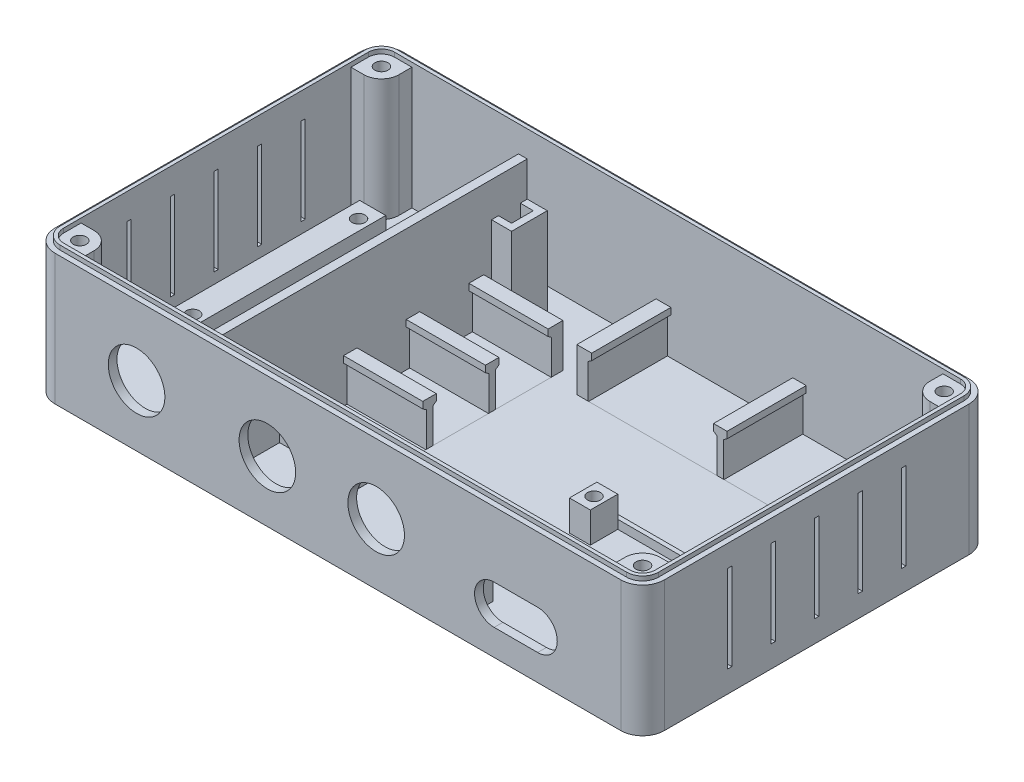
from build123d import *

# Parameters (mm, degrees)
SKETCH1_W                                  = 140
SKETCH1_H                                  = 80
BOSS_EXTRUDE1_DEPTH                        = 30
FILLET1_R                                  = 5
SHELL1_T                                   = -2
SKETCH2_W                                  = 6
SKETCH2_H                                  = 45.65
BOSS_EXTRUDE2_DEPTH                        = 4.5
SKETCH3_W                                  = 0.5
SKETCH3_H                                  = 5
CUT_EXTRUDE1_DEPTH                         = 1.5
SKETCH4_R                                  = 1.5
CUT_EXTRUDE2_DEPTH                         = 4.5
SKETCH5_W                                  = 2
SKETCH5_H                                  = 71
BOSS_EXTRUDE3_DEPTH                        = 28
BOSS_EXTRUDE4_START                        = 28
BOSS_EXTRUDE4_DEPTH                        = 28
MIRROR2_START                              = 28
MIRROR2_AT_THE_SECOND_PLANE_COPY_1_DEPTH   = 28
BOSS_EXTRUDE5_DEPTH                        = 18.2
SKETCH8_W                                  = 29.6
SKETCH8_H                                  = 18.2
CUT_EXTRUDE3_DEPTH                         = 0.1
BOSS_EXTRUDE6_DEPTH                        = 18.2
SKETCH10_W                                 = 18.2
SKETCH10_H                                 = 12.9
CUT_EXTRUDE4_DEPTH                         = 0.1
SKETCH11_R                                 = 6.5
CUT_EXTRUDE5_DEPTH                         = 110.013760599
SKETCH13_W                                 = 4.8
SKETCH13_H                                 = 6.3
SKETCH13_H_2                               = 7
BOSS_EXTRUDE7_DEPTH                        = 7
SKETCH14_W                                 = 38.2
SKETCH14_H                                 = 1
BOSS_EXTRUDE8_DEPTH                        = 2
SKETCH15_R                                 = 1.5
CUT_EXTRUDE6_DEPTH                         = 7
CUT_EXTRUDE7_DEPTH                         = 110.013760599
SKETCH19_R                                 = 1.5
CUT_EXTRUDE8_DEPTH                         = 20
MIRROR3_AT_THE_SECOND_PLANE_COPY_1_SKETC_R = 1.5
MIRROR3_AT_THE_SECOND_PLANE_COPY_1_DEPTH   = 20
BOSS_EXTRUDE9_DEPTH                        = 1
CUT_EXTRUDE9_REACH                         = 150.866
SKETCH21_W                                 = 1
SKETCH21_H                                 = 20
CUT_EXTRUDE10_REACH                        = 92
BOSS_EXTRUDE10_DEPTH                       = 20


with BuildPart() as part:
    # Sketch1 → Boss-Extrude1 (new body)
    with BuildSketch(Plane(origin=(0, 0, 0), x_dir=(1, 0, 0), z_dir=(0, 1, 0))):
        Rectangle(SKETCH1_W, SKETCH1_H)
    extrude(amount=BOSS_EXTRUDE1_DEPTH)

    # Fillet1
    fillet1_edges = [part.edges().sort_by_distance(p)[0] for p in [
        (70, 15, 40),
        (-70, 15, 40),
        (-70, 15, -40),
        (70, 15, -40),
    ]]
    fillet(fillet1_edges, radius=FILLET1_R)

    # Shell1
    shell1_openings = [part.faces().sort_by_distance(p)[0] for p in [
        (0, 30, 0),
    ]]
    offset(amount=SHELL1_T, openings=shell1_openings, kind=Kind.INTERSECTION)

    # Sketch2 → Boss-Extrude2 (add)
    with BuildSketch(Plane(origin=(0, 2, 0), x_dir=(1, 0, 0), z_dir=(0, 1, 0))):
        with Locations((-38.5, 6.175)):
            Rectangle(SKETCH2_W, SKETCH2_H)
    boss_extrude2 = extrude(amount=BOSS_EXTRUDE2_DEPTH)

    # Sketch3 → Cut-Extrude1 (cut)
    with BuildSketch(Plane(origin=(0, 6.5, 0), x_dir=(1, 0, 0), z_dir=(0, 1, 0))):
        with Locations((-41.25, 25.5)):
            Rectangle(SKETCH3_W, SKETCH3_H)
    extrude(amount=-CUT_EXTRUDE1_DEPTH, mode=Mode.SUBTRACT)

    # Mirror1: Boss-Extrude2 across plane
    add(boss_extrude2.mirror(Plane(origin=(-49.75, 0, 0), x_dir=(0, 0, 1), z_dir=(1, 0, 0))))

    # Sketch4 → Cut-Extrude2 (cut)
    with BuildSketch(Plane(origin=(0, 6.5, 0), x_dir=(1, 0, 0), z_dir=(0, 1, 0))):
        with Locations(Location((-60.475, 25.225, 0), (0, 0, 270))):
            Circle(SKETCH4_R)
        with Locations(Location((-39.025, 25.225, 0), (0, 0, 270))):
            Circle(SKETCH4_R)
        with Locations(Location((-39.025, -12.875, 0), (0, 0, 270))):
            Circle(SKETCH4_R)
        with Locations(Location((-60.475, -12.875, 0), (0, 0, 270))):
            Circle(SKETCH4_R)
    extrude(amount=-CUT_EXTRUDE2_DEPTH, mode=Mode.SUBTRACT)

    # Sketch5 → Boss-Extrude3 (add)
    with BuildSketch(Plane(origin=(0, 2, 0), x_dir=(1, 0, 0), z_dir=(0, 1, 0))):
        with Locations((-30.5, -2.5)):
            Rectangle(SKETCH5_W, SKETCH5_H)
    extrude(amount=BOSS_EXTRUDE3_DEPTH)

    # Sketch6 → Boss-Extrude4 (add)
    with BuildSketch(Plane(origin=(0, 2, 0), x_dir=(1, 0, 0), z_dir=(0, 1, 0)).offset(BOSS_EXTRUDE4_START)):
        with BuildLine():
            Line((61, 35), (61, 38))
            Line((61, 38), (65, 38))
            ThreePointArc((65, 38), (67.121320344, 37.121320344), (68, 35))
            Line((68, 35), (68, 31))
            Line((68, 31), (65, 31))
            ThreePointArc((65, 31), (62.171572875, 32.171572875), (61, 35))
        make_face()
    boss_extrude4 = extrude(amount=-BOSS_EXTRUDE4_DEPTH)

    # Mirror2: Boss-Extrude4 across plane
    add(boss_extrude4.mirror(Plane.XY))

    # Mirror2 at the second plane: Boss-Extrude4 across plane
    add(boss_extrude4.mirror(Plane(origin=(0, 0, 0), x_dir=(0, 0, 1), z_dir=(1, 0, 0))))

    # Mirror2 at the second plane copy 1 sketc → Mirror2 at the second plane copy 1 (add)
    with BuildSketch(Plane(origin=(0, 2, 0), x_dir=(-1, 0, 0), z_dir=(0, 1, 0)).offset(MIRROR2_START)):
        with BuildLine():
            Line((61, 35), (61, 38))
            Line((61, 38), (65, 38))
            ThreePointArc((65, 38), (67.121320344, 37.121320344), (68, 35))
            Line((68, 35), (68, 31))
            Line((68, 31), (65, 31))
            ThreePointArc((65, 31), (62.171572875, 32.171572875), (61, 35))
        make_face()
    extrude(amount=-MIRROR2_AT_THE_SECOND_PLANE_COPY_1_DEPTH)

    # Sketch7 → Boss-Extrude5 (add)
    with BuildSketch(Plane.XY.offset(-38)):
        Polygon((61, 2), (61, 11.960166031), (57.6, 11.960166031), (57.6, 10.460166031), (58.4, 9.9), (58.4, 2), align=None)
        Polygon((28.8, 2), (28.8, 9.9), (29.6, 10.460166031), (29.6, 11.960166031), (26.5, 11.960166031), (26.5, 10.460166031), (27.3, 9.9), (27.3, 2), align=None)
        Polygon((-2.3, 2), (-4.9, 2), (-4.9, 11.960166031), (-1.5, 11.960166031), (-1.5, 10.460166031), (-2.3, 9.9), align=None)
    extrude(amount=BOSS_EXTRUDE5_DEPTH)

    # Sketch8 → Cut-Extrude3 (cut)
    with BuildSketch(Plane(origin=(0, 2, 0), x_dir=(1, 0, 0), z_dir=(0, 1, 0))):
        with Locations((12.5, 28.9)):
            Rectangle(SKETCH8_W, SKETCH8_H)
        with Locations((43.6, 28.9)):
            Rectangle(SKETCH8_W, SKETCH8_H)
    extrude(amount=-CUT_EXTRUDE3_DEPTH, mode=Mode.SUBTRACT)

    # Sketch9 → Boss-Extrude6 (add)
    with BuildSketch(Plane(origin=(-29.5, 0, 0), x_dir=(0, 0, -1), z_dir=(1, 0, 0))):
        Polygon((23, 2), (23, 11.960166031), (19.6, 11.960166031), (19.6, 10.460166031), (20.4, 9.9), (20.4, 2), align=None)
        Polygon((7.5, 2), (7.5, 9.9), (8.3, 10.460166031), (8.3, 11.960166031), (5.2, 11.960166031), (5.2, 10.460166031), (6, 9.9), (6, 2), align=None)
        Polygon((-6.9, 2), (-6.9, 9.9), (-6.1, 10.460166031), (-6.1, 11.960166031), (-9.2, 11.960166031), (-9.2, 10.460166031), (-8.4, 9.9), (-8.4, 2), align=None)
        Polygon((-21.3, 2), (-23.9, 2), (-23.9, 11.960166031), (-20.5, 11.960166031), (-20.5, 10.460166031), (-21.3, 9.9), align=None)
    extrude(amount=BOSS_EXTRUDE6_DEPTH)

    # Sketch10 → Cut-Extrude4 (cut)
    with BuildSketch(Plane(origin=(0, 2, 0), x_dir=(1, 0, 0), z_dir=(0, 1, 0))):
        with Locations((-20.4, -14.85)):
            Rectangle(SKETCH10_W, SKETCH10_H)
        with Locations((-20.4, -0.45)):
            Rectangle(SKETCH10_W, SKETCH10_H)
        with Locations((-20.4, 13.95)):
            Rectangle(SKETCH10_W, SKETCH10_H)
    extrude(amount=-CUT_EXTRUDE4_DEPTH, mode=Mode.SUBTRACT)

    # Sketch11 → Cut-Extrude5 (cut, through all)
    with BuildSketch(Plane(origin=(0, 0, 38), x_dir=(-1, 0, 0), z_dir=(0, 0, -1))):
        with Locations((-8.8, 14)):
            Circle(SKETCH11_R)
        with Locations((16.2, 14)):
            Circle(SKETCH11_R)
        with Locations((46.25, 14)):
            Circle(SKETCH11_R)
    extrude(amount=-CUT_EXTRUDE5_DEPTH, mode=Mode.SUBTRACT)

    # Sketch13 → Boss-Extrude7 (add)
    with BuildSketch(Plane(origin=(0, 2, 0), x_dir=(1, 0, 0), z_dir=(0, 1, 0))):
        with Locations((24.2, -5.45)):
            Rectangle(SKETCH13_W, SKETCH13_H)
        with Locations((57.6, -5.45)):
            Rectangle(SKETCH13_W, SKETCH13_H)
        with Locations((24.2, -34.5)):
            Rectangle(SKETCH13_W, SKETCH13_H_2)
        with Locations((57.6, -34.5)):
            Rectangle(SKETCH13_W, SKETCH13_H_2)
    extrude(amount=BOSS_EXTRUDE7_DEPTH)

    # Sketch14 → Boss-Extrude8 (add)
    with BuildSketch(Plane(origin=(0, 2, 0), x_dir=(1, 0, 0), z_dir=(0, 1, 0))):
        with Locations((40.9, -1.8)):
            Rectangle(SKETCH14_W, SKETCH14_H)
    extrude(amount=BOSS_EXTRUDE8_DEPTH)

    # Sketch15 → Cut-Extrude6 (cut)
    with BuildSketch(Plane(origin=(0, 9, 0), x_dir=(1, 0, 0), z_dir=(0, 1, 0))):
        with Locations(Location((24.3, -5.45, 0), (0, 0, 270))):
            Circle(SKETCH15_R)
        with Locations(Location((57.5, -5.45, 0), (0, 0, 270))):
            Circle(SKETCH15_R)
        with Locations(Location((24.3, -34.5, 0), (0, 0, 270))):
            Circle(SKETCH15_R)
        with Locations(Location((57.5, -34.5, 0), (0, 0, 270))):
            Circle(SKETCH15_R)
    extrude(amount=-CUT_EXTRUDE6_DEPTH, mode=Mode.SUBTRACT)

    # Sketch18 → Cut-Extrude7 (cut, through all)
    with BuildSketch(Plane(origin=(0, 0, 38), x_dir=(-1, 0, 0), z_dir=(0, 0, -1))):
        with BuildLine():
            Line((-45.9, 15), (-35.9, 15))
            ThreePointArc((-35.9, 15), (-31.4, 10.5), (-35.9, 6))
            Line((-35.9, 6), (-45.9, 6))
            ThreePointArc((-45.9, 6), (-50.4, 10.5), (-45.9, 15))
        make_face()
    extrude(amount=-CUT_EXTRUDE7_DEPTH, mode=Mode.SUBTRACT)

    # Sketch19 → Cut-Extrude8 (cut)
    with BuildSketch(Plane(origin=(0, 30, 0), x_dir=(1, 0, 0), z_dir=(0, 1, 0))):
        with Locations(Location((-64.646446609, -34.646446609, 0), (0, 0, 270))):
            Circle(SKETCH19_R)
    cut_extrude8 = extrude(amount=-CUT_EXTRUDE8_DEPTH, mode=Mode.SUBTRACT)

    # Mirror3: Cut-Extrude8 across plane
    add(cut_extrude8.mirror(Plane(origin=(0, 0, 0), x_dir=(0, 0, 1), z_dir=(1, 0, 0))), mode=Mode.SUBTRACT)

    # Mirror3 at the second plane: Cut-Extrude8 across plane
    add(cut_extrude8.mirror(Plane.XY), mode=Mode.SUBTRACT)

    # Mirror3 at the second plane copy 1 sketc → Mirror3 at the second plane copy 1 (cut)
    with BuildSketch(Plane(origin=(0, 30, 0), x_dir=(-1, 0, 0), z_dir=(0, 1, 0))):
        with Locations(Location((-64.646446609, -34.646446609, 0), (0, 0, 270))):
            Circle(MIRROR3_AT_THE_SECOND_PLANE_COPY_1_SKETC_R)
    extrude(amount=-MIRROR3_AT_THE_SECOND_PLANE_COPY_1_DEPTH, mode=Mode.SUBTRACT)

    # Sketch20 → Boss-Extrude9 (add)
    with BuildSketch(Plane(origin=(0, 30, 0), x_dir=(1, 0, 0), z_dir=(0, 1, 0))):
        with BuildLine():
            Line((-68.8, -35), (-68.8, 0))
            Line((-68.8, 0), (-68.8, 35))
            ThreePointArc((-68.8, 35), (-67.687005769, 37.687005769), (-65, 38.8))
            Line((-65, 38.8), (65, 38.8))
            ThreePointArc((65, 38.8), (67.687005769, 37.687005769), (68.8, 35))
            Line((68.8, 35), (68.8, -35.119471584))
            ThreePointArc((68.8, -35.119471584), (67.721998185, -37.721998185), (65.119471584, -38.8))
            Line((65.119471584, -38.8), (-65, -38.8))
            ThreePointArc((-65, -38.8), (-67.687005769, -37.687005769), (-68.8, -35))
        make_face()
        with BuildLine():
            Line((-68, 0), (-68, 35))
            ThreePointArc((-68, 35), (-67.121320344, 37.121320344), (-65, 38))
            Line((-65, 38), (65, 38))
            ThreePointArc((65, 38), (67.121320344, 37.121320344), (68, 35))
            Line((68, 35), (68, -35.119471584))
            ThreePointArc((68, -35.119471584), (67.15631276, -37.15631276), (65.119471584, -38))
            Line((65.119471584, -38), (-65, -38))
            ThreePointArc((-65, -38), (-67.121320344, -37.121320344), (-68, -35))
            Line((-68, -35), (-68, 0))
        make_face(mode=Mode.SUBTRACT)
    extrude(amount=BOSS_EXTRUDE9_DEPTH)

    # Sketch21 → Cut-Extrude9 (cut, up to next)
    with BuildSketch(Plane(origin=(70, 0, 0), x_dir=(0, 0, -1), z_dir=(1, 0, 0)), mode=Mode.PRIVATE) as cut_extrude9_sk1:
        with Locations((-20, 15)):
            Rectangle(SKETCH21_W, SKETCH21_H)
    cut_extrude9_tool1 = extrude(cut_extrude9_sk1.sketch, amount=-CUT_EXTRUDE9_REACH, mode=Mode.PRIVATE) & part.part
    # Sketch21 → Cut-Extrude9 (cut, up to next)
    with BuildSketch(Plane(origin=(70, 0, 0), x_dir=(0, 0, -1), z_dir=(1, 0, 0)), mode=Mode.PRIVATE) as cut_extrude9_sk2:
        with Locations((-10, 15)):
            Rectangle(SKETCH21_W, SKETCH21_H)
    cut_extrude9_tool2 = extrude(cut_extrude9_sk2.sketch, amount=-CUT_EXTRUDE9_REACH, mode=Mode.PRIVATE) & part.part
    # Sketch21 → Cut-Extrude9 (cut, up to next)
    with BuildSketch(Plane(origin=(70, 0, 0), x_dir=(0, 0, -1), z_dir=(1, 0, 0)), mode=Mode.PRIVATE) as cut_extrude9_sk3:
        with Locations((0, 15)):
            Rectangle(SKETCH21_W, SKETCH21_H)
    cut_extrude9_tool3 = extrude(cut_extrude9_sk3.sketch, amount=-CUT_EXTRUDE9_REACH, mode=Mode.PRIVATE) & part.part
    # Sketch21 → Cut-Extrude9 (cut, up to next)
    with BuildSketch(Plane(origin=(70, 0, 0), x_dir=(0, 0, -1), z_dir=(1, 0, 0)), mode=Mode.PRIVATE) as cut_extrude9_sk4:
        with Locations((10, 15)):
            Rectangle(SKETCH21_W, SKETCH21_H)
    cut_extrude9_tool4 = extrude(cut_extrude9_sk4.sketch, amount=-CUT_EXTRUDE9_REACH, mode=Mode.PRIVATE) & part.part
    # Sketch21 → Cut-Extrude9 (cut, up to next)
    with BuildSketch(Plane(origin=(70, 0, 0), x_dir=(0, 0, -1), z_dir=(1, 0, 0)), mode=Mode.PRIVATE) as cut_extrude9_sk5:
        with Locations((20, 15)):
            Rectangle(SKETCH21_W, SKETCH21_H)
    cut_extrude9_tool5 = extrude(cut_extrude9_sk5.sketch, amount=-CUT_EXTRUDE9_REACH, mode=Mode.PRIVATE) & part.part
    cut_extrude9_1 = cut_extrude9_tool1.solids().sort_by_distance((70, 15, 20))[0]
    add(cut_extrude9_1, mode=Mode.SUBTRACT)
    cut_extrude9_2 = cut_extrude9_tool2.solids().sort_by_distance((70, 15, 10))[0]
    add(cut_extrude9_2, mode=Mode.SUBTRACT)
    cut_extrude9_3 = cut_extrude9_tool3.solids().sort_by_distance((70, 15, 0))[0]
    add(cut_extrude9_3, mode=Mode.SUBTRACT)
    cut_extrude9_4 = cut_extrude9_tool4.solids().sort_by_distance((70, 15, -10))[0]
    add(cut_extrude9_4, mode=Mode.SUBTRACT)
    cut_extrude9_5 = cut_extrude9_tool5.solids().sort_by_distance((70, 15, -20))[0]
    add(cut_extrude9_5, mode=Mode.SUBTRACT)
    cut_extrude9 = cut_extrude9_1 + cut_extrude9_2 + cut_extrude9_3 + cut_extrude9_4 + cut_extrude9_5  # Cut-Extrude9 as one shape, for the pattern or mirror that repeats it

    # Mirror4: Cut-Extrude9 across plane
    add(cut_extrude9.mirror(Plane(origin=(0, 0, 0), x_dir=(0, 0, 1), z_dir=(1, 0, 0))), mode=Mode.SUBTRACT)

    # Sketch23 → Cut-Extrude10 (cut, up to next)
    with BuildSketch(Plane(origin=(0, 40, 0), x_dir=(1, 0, 0), z_dir=(0, 1, 0)), mode=Mode.PRIVATE) as cut_extrude10_sk1:
        with BuildLine():
            Line((-54.75, 35.5), (-44.75, 35.5))
            ThreePointArc((-44.75, 35.5), (-42.75, 33.5), (-44.75, 31.5))
            Line((-44.75, 31.5), (-54.75, 31.5))
            ThreePointArc((-54.75, 31.5), (-56.75, 33.5), (-54.75, 35.5))
        make_face()
    cut_extrude10_tool1 = extrude(cut_extrude10_sk1.sketch, amount=-CUT_EXTRUDE10_REACH, mode=Mode.PRIVATE) & part.part
    # Sketch23 → Cut-Extrude10 (cut, up to next)
    with BuildSketch(Plane(origin=(0, 40, 0), x_dir=(1, 0, 0), z_dir=(0, 1, 0)), mode=Mode.PRIVATE) as cut_extrude10_sk2:
        with BuildLine():
            Line((63.5, -14.8), (63.5, -24.8))
            ThreePointArc((63.5, -24.8), (61.5, -26.8), (59.5, -24.8))
            Line((59.5, -24.8), (59.5, -14.8))
            ThreePointArc((59.5, -14.8), (61.5, -12.8), (63.5, -14.8))
        make_face()
    cut_extrude10_tool2 = extrude(cut_extrude10_sk2.sketch, amount=-CUT_EXTRUDE10_REACH, mode=Mode.PRIVATE) & part.part
    add(cut_extrude10_tool1.solids().sort_by_distance((-49.75, 40, -33.5))[0], mode=Mode.SUBTRACT)
    add(cut_extrude10_tool2.solids().sort_by_distance((61.5, 40, 19.8))[0], mode=Mode.SUBTRACT)

    # Sketch25 → Boss-Extrude10 (add)
    with BuildSketch(Plane(origin=(0, 2, 0), x_dir=(1, 0, 0), z_dir=(0, 1, 0))):
        Polygon((-29.5, 33), (-24.9, 33), (-24.9, 24.8), (-29.5, 24.8), (-29.5, 26.4), (-26.5, 26.4), (-26.5, 31.4), (-29.5, 31.4), align=None)
    extrude(amount=BOSS_EXTRUDE10_DEPTH)


solid = part.part
